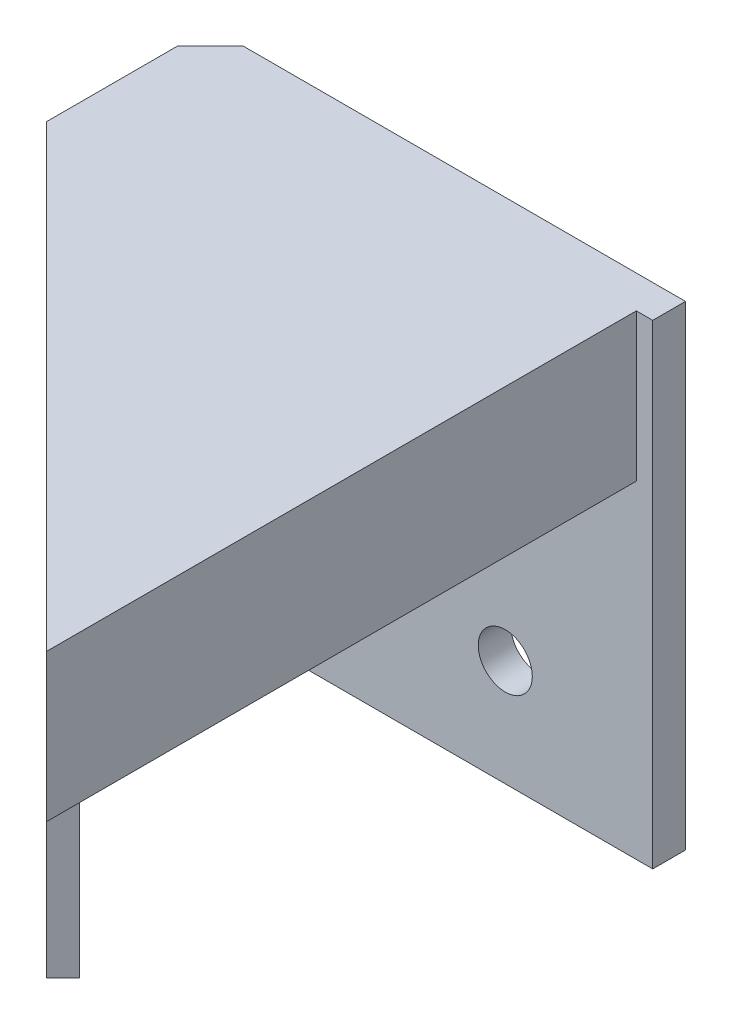
from build123d import *

# Parameters (mm, degrees)
SKETCH1_W                      = 27
SKETCH1_H                      = 29
BOSS_EXTRUDE1_DEPTH            = 2
SKETCH4_W                      = 10
SKETCH4_H                      = 29
BOSS_EXTRUDE3_DEPTH            = 2
BOSS_EXTRUDE4_DEPTH            = 29
SKETCH6_R                      = 1.65
CUT_EXTRUDE1_DEPTH             = 2
CHAMFER1_SIZE                  = 1
SKETCH7_W                      = 23
SKETCH7_H                      = 7
CUT_EXTRUDE3_DEPTH             = 2
CUT_EXTRUDE3_DIRECTION_2_REACH = 48.872
BOSS_EXTRUDE6_REACH            = 49.938
SKETCH9_W                      = 28
SKETCH9_H                      = 9
SKETCH9_W_2                    = 23
SKETCH9_H_2                    = 7
CHAMFER3_SIZE                  = 2
SKETCH10_R                     = 1.65
CUT_EXTRUDE4_DEPTH             = 10
SKETCH11_W                     = 2.8
SKETCH11_H                     = 2.9
BOSS_EXTRUDE7_DEPTH            = 3


with BuildPart() as part:
    # Sketch1 → Boss-Extrude1 (new body)
    with BuildSketch(Plane.XY):
        with Locations((-3.250075758, -20.95)):
            Rectangle(SKETCH1_W, SKETCH1_H)
    extrude(amount=BOSS_EXTRUDE1_DEPTH)

    # Sketch4 → Boss-Extrude3 (add)
    with BuildSketch(Plane.ZY.offset(16.750075758)):
        with Locations((5, -20.95)):
            Rectangle(SKETCH4_W, SKETCH4_H)
    extrude(amount=BOSS_EXTRUDE3_DEPTH)

    # Sketch5 → Boss-Extrude4 (add)
    with BuildSketch(Plane.XZ.offset(35.45)):
        Polygon((-18.750075758, 10), (-2.48661979, 26.263455967), (-1.48661979, 25.263455967), (-16.750075758, 10), align=None)
    extrude(amount=-BOSS_EXTRUDE4_DEPTH)

    # Sketch6 → Cut-Extrude1 (cut)
    with BuildSketch(Plane(origin=(-13.375037879, 0, 13.375037879), x_dir=(-0.7071067811865435, 0, -0.7071067811865517), z_dir=(0.7071067811865517, 0, -0.7071067811865435))):
        with Locations((-11.812762096, -32.45)):
            Circle(SKETCH6_R)
        with Locations((-11.812762096, -18.45)):
            Circle(SKETCH6_R)
    extrude(amount=-CUT_EXTRUDE1_DEPTH, mode=Mode.SUBTRACT)

    # Chamfer1
    chamfer1_edges = [part.edges().sort_by_distance(p)[0] for p in [
        (-16.750075758, -20.95, 2),
    ]]
    chamfer(chamfer1_edges, length=CHAMFER1_SIZE)

    # Sketch7 → Cut-Extrude3 (cut)
    with BuildSketch(Plane.XY.offset(2)):
        with Locations((-3.250075758, -10.95)):
            Rectangle(SKETCH7_W, SKETCH7_H)
    extrude(amount=-CUT_EXTRUDE3_DEPTH, mode=Mode.SUBTRACT)

    # Cut-Extrude3 direction 2: up to this plane
    cut_extrude3_direction_2_end = Plane(origin=(-18.750075758, 17.267649798, 10), z_dir=(-0.7071067811865512, 0, 0.7071067811865439))
    # Sketch7 → Cut-Extrude3 direction 2 (cut, up to the surface)
    with BuildSketch(Plane.XY.offset(2), mode=Mode.PRIVATE) as cut_extrude3_direction_2_sk1:
        with Locations((-3.250075758, -10.95)):
            Rectangle(SKETCH7_W, SKETCH7_H)
    cut_extrude3_direction_2_tool1 = split(extrude(cut_extrude3_direction_2_sk1.sketch, amount=CUT_EXTRUDE3_DIRECTION_2_REACH, mode=Mode.PRIVATE), bisect_by=cut_extrude3_direction_2_end, keep=Keep.BOTH, mode=Mode.PRIVATE)
    add(cut_extrude3_direction_2_tool1.solids().sort_by_distance((-3.250076, -10.95, 2))[0], mode=Mode.SUBTRACT)

    # Boss-Extrude6: up to this plane
    boss_extrude6_end = Plane(origin=(-18.750075758, 17.267649798, 10), z_dir=(-0.7071067811865512, 0, 0.7071067811865439))
    # Sketch9 → Boss-Extrude6 (add, up to the surface)
    with BuildSketch(Plane(origin=(0, 0, 0), x_dir=(-1, 0, 0), z_dir=(0, 0, -1)), mode=Mode.PRIVATE) as boss_extrude6_sk1:
        with Locations((4.750075758, -10.95)):
            Rectangle(SKETCH9_W, SKETCH9_H)
        with Locations((3.250075758, -10.95)):
            Rectangle(SKETCH9_W_2, SKETCH9_H_2, mode=Mode.SUBTRACT)
    boss_extrude6_tool1 = split(extrude(boss_extrude6_sk1.sketch, amount=-BOSS_EXTRUDE6_REACH, mode=Mode.PRIVATE), bisect_by=boss_extrude6_end, keep=Keep.BOTH, mode=Mode.PRIVATE)
    add(boss_extrude6_tool1.solids().sort_by_distance((-4.750076, -15.155891, 0))[0])

    # Chamfer3
    chamfer3_edges = [part.edges().sort_by_distance(p)[0] for p in [
        (-18.750075758, -20.95, 0),
    ]]
    chamfer(chamfer3_edges, length=CHAMFER3_SIZE)

    # Sketch10 → Cut-Extrude4 (cut)
    with BuildSketch(Plane.XY.offset(2)):
        with Locations((1.249924242, -28.95)):
            Circle(SKETCH10_R)
    extrude(amount=-CUT_EXTRUDE4_DEPTH, mode=Mode.SUBTRACT)

    # Sketch11 → Boss-Extrude7 (add)
    with BuildSketch(Plane(origin=(0, 0, 0), x_dir=(-1, 0, 0), z_dir=(0, 0, -1))):
        with Locations((-4.749924242, -15.9)):
            Rectangle(SKETCH11_W, SKETCH11_H)
        with Locations((11.250075758, -15.9)):
            Rectangle(SKETCH11_W, SKETCH11_H)
    extrude(amount=BOSS_EXTRUDE7_DEPTH)


solid = part.part
